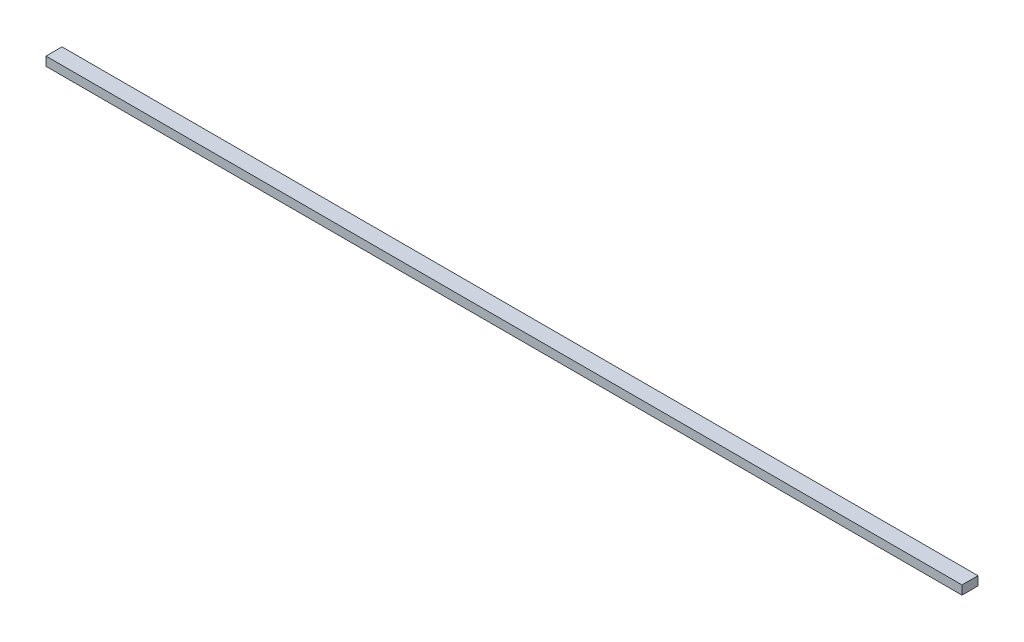
from build123d import *

# Parameters (mm, degrees)
SKETCH_1_W      = 515
SKETCH_1_H      = 9
EXTRUDE_1_DEPTH = 5


with BuildPart() as part:
    # 草图1 → 凸台-拉伸1 (new body)
    with BuildSketch(Plane(origin=(0, 0, 0), x_dir=(1, 0, 0), z_dir=(0, 1, 0))):
        Rectangle(SKETCH_1_W, SKETCH_1_H)
    extrude(amount=EXTRUDE_1_DEPTH)


solid = part.part
